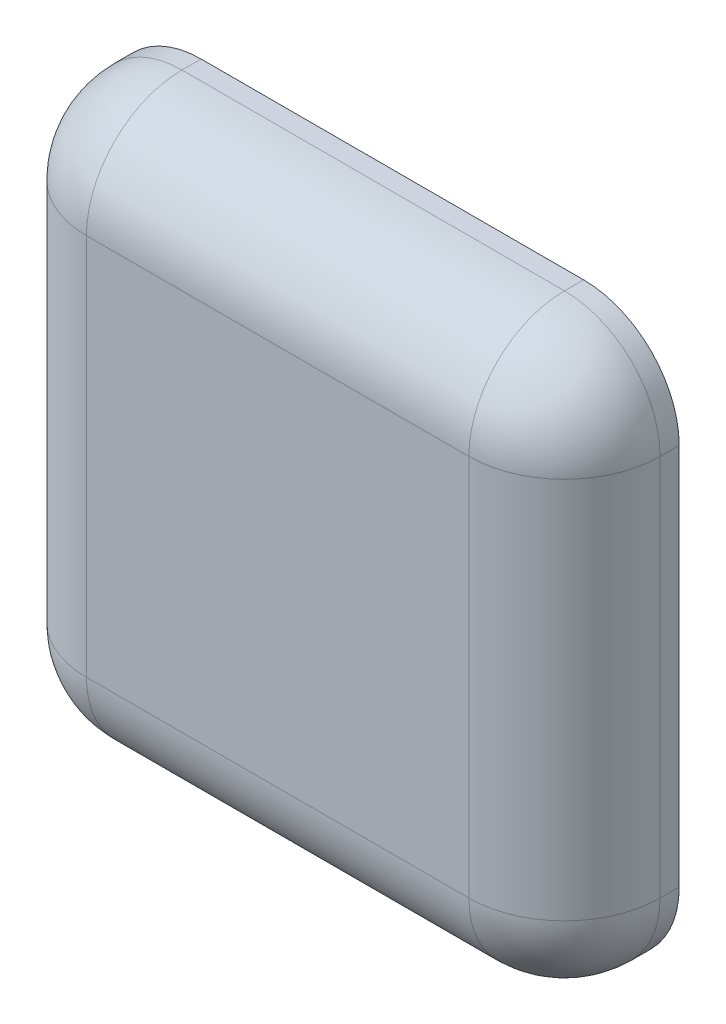
from build123d import *

# Parameters (mm, degrees)
SKETCH1_W           = 300
SKETCH1_H           = 300
BOSS_EXTRUDE1_DEPTH = 60
FILLET1_R           = 50


with BuildPart() as part:
    # Sketch1 → Boss-Extrude1 (new body)
    with BuildSketch(Plane.XY):
        with Locations((68.518518519, -32.407407407)):
            Rectangle(SKETCH1_W, SKETCH1_H)
    extrude(amount=BOSS_EXTRUDE1_DEPTH)

    # Fillet1
    fillet1_edges = [part.edges().sort_by_distance(p)[0] for p in [
        (68.518518519, -182.407407407, 60),
        (218.518518519, -32.407407407, 60),
        (68.518518519, 117.592592593, 60),
        (218.518518519, 117.592592593, 30),
        (218.518518519, -182.407407407, 30),
        (-81.481481481, -182.407407407, 30),
        (-81.481481481, 117.592592593, 30),
        (-81.481481481, -32.407407407, 60),
    ]]
    fillet(fillet1_edges, radius=FILLET1_R)


solid = part.part
